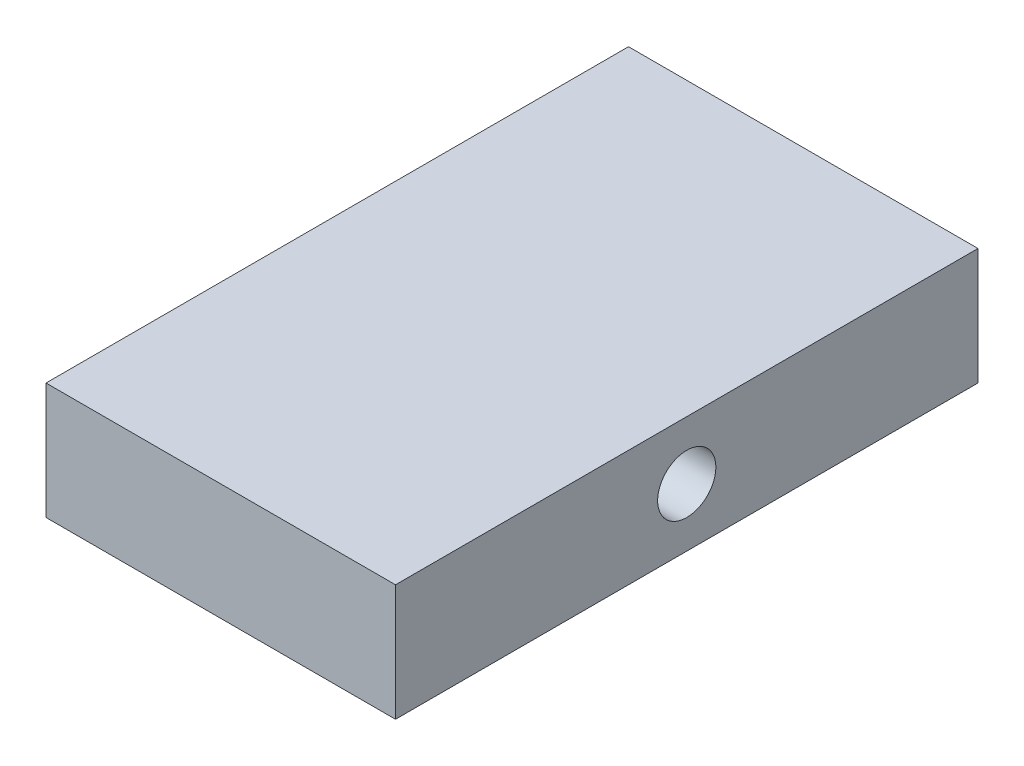
from build123d import *

# Parameters (mm, degrees)
SKETCH2_W           = 127
SKETCH2_H           = 25.4
BOSS_EXTRUDE1_DEPTH = 76.2
SKETCH3_R           = 6.35
CUT_EXTRUDE1_DEPTH  = 63.5


with BuildPart() as part:
    # Sketch2 → Boss-Extrude1 (new body)
    with BuildSketch(Plane(origin=(0, 0, 0), x_dir=(0, 0, -1), z_dir=(1, 0, 0))):
        Rectangle(SKETCH2_W, SKETCH2_H)
    extrude(amount=BOSS_EXTRUDE1_DEPTH)

    # Sketch3 → Cut-Extrude1 (cut)
    with BuildSketch(Plane(origin=(76.2, 0, 0), x_dir=(0, 0, -1), z_dir=(1, 0, 0))):
        Circle(SKETCH3_R)
    extrude(amount=-CUT_EXTRUDE1_DEPTH, mode=Mode.SUBTRACT)


solid = part.part
